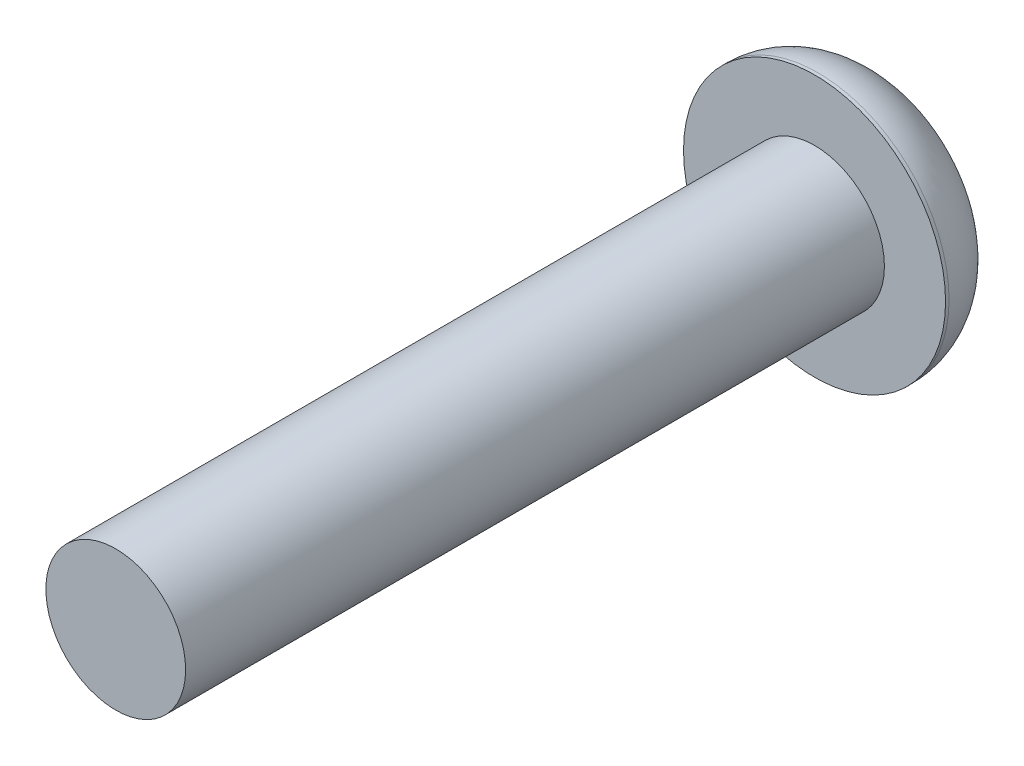
from build123d import *

# Parameters (mm, degrees)
SKETCH_1_R      = 2
EXTRUDE_1_DEPTH = 20
SKETCH_2_R      = 3.75
EXTRUDE_2_DEPTH = 2.1
FILLET_1_R      = 2


with BuildPart() as part:
    # 草图1 → 凸台-拉伸1 (new body)
    with BuildSketch(Plane.XY):
        Circle(SKETCH_1_R)
    extrude(amount=EXTRUDE_1_DEPTH)

    # 草图2 → 凸台-拉伸2 (add)
    with BuildSketch(Plane(origin=(0, 0, 0), x_dir=(-1, 0, 0), z_dir=(0, 0, -1))):
        Circle(SKETCH_2_R)
    extrude(amount=EXTRUDE_2_DEPTH)

    # 圆角1
    fillet_1_edges = [part.edges().sort_by_distance(p)[0] for p in [
        (3.75, 0, -2.1),
    ]]
    fillet(fillet_1_edges, radius=FILLET_1_R)


solid = part.part
